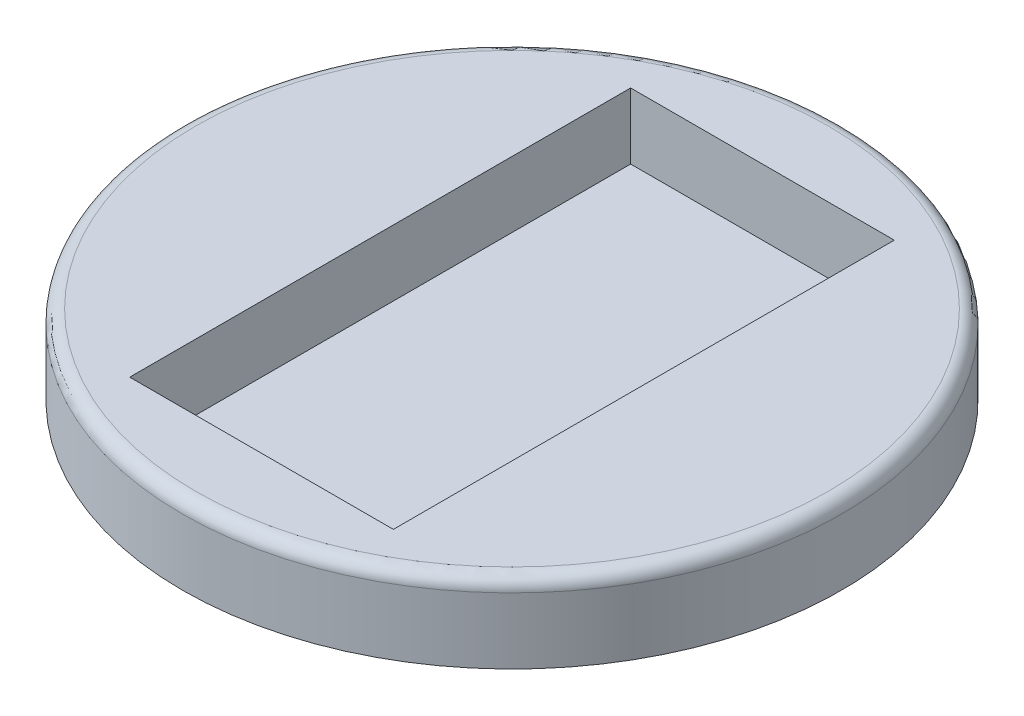
from build123d import *

# Parameters (mm, degrees)
SKETCH1_R           = 25
BOSS_EXTRUDE1_DEPTH = 6
SKETCH2_W           = 20
SKETCH2_H           = 38
CUT_EXTRUDE1_DEPTH  = 5
FILLET1_R           = 1


with BuildPart() as part:
    # Sketch1 → Boss-Extrude1 (new body)
    with BuildSketch(Plane(origin=(0, 0, 0), x_dir=(1, 0, 0), z_dir=(0, 1, 0))):
        with Locations(Location((0, 0, 0), (0, 0, 270))):
            Circle(SKETCH1_R)
    extrude(amount=BOSS_EXTRUDE1_DEPTH)

    # Sketch2 → Cut-Extrude1 (cut)
    with BuildSketch(Plane(origin=(0, 6, 0), x_dir=(1, 0, 0), z_dir=(0, 1, 0))):
        Rectangle(SKETCH2_W, SKETCH2_H)
    extrude(amount=-CUT_EXTRUDE1_DEPTH, mode=Mode.SUBTRACT)

    # Fillet1
    fillet1_edges = [part.edges().sort_by_distance(p)[0] for p in [
        (0, 6, -25),
    ]]
    fillet(fillet1_edges, radius=FILLET1_R)


solid = part.part
